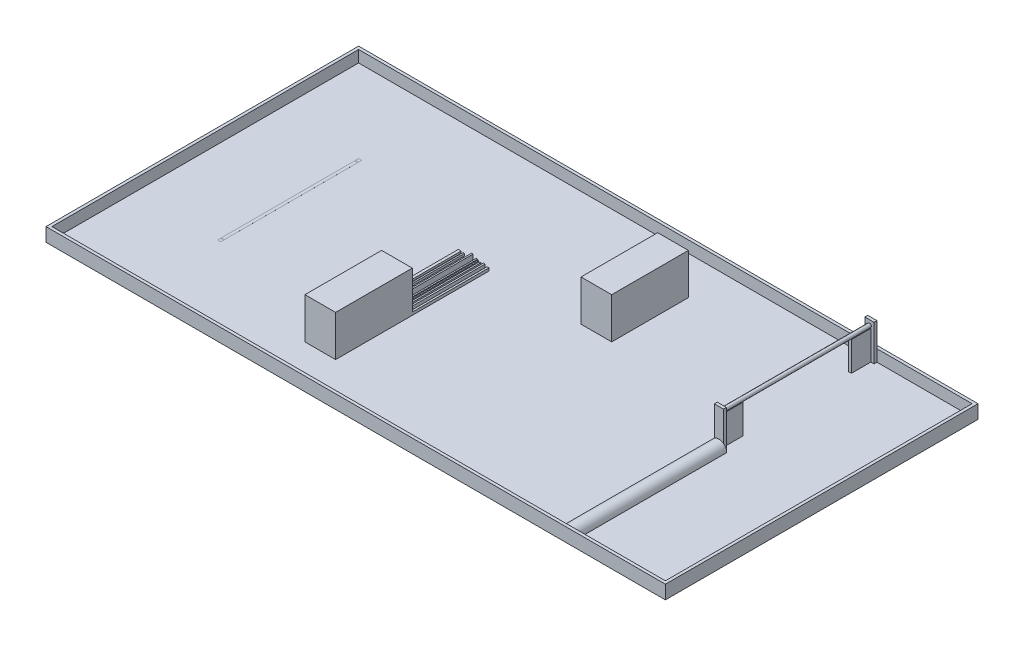
from build123d import *

# Parameters (mm, degrees)
SKETCH1_W            = 4000
SKETCH1_H            = 2000
BOSS_EXTRUDE1_DEPTH  = 12.7
SKETCH3_W            = 4038.1
SKETCH3_H            = 2038.1
SKETCH3_W_2          = 4000
SKETCH3_H_2          = 2000
BOSS_EXTRUDE2_DEPTH  = 88.9
SKETCH4_W            = 20
SKETCH4_H            = 20
BOSS_EXTRUDE3_DEPTH  = 0.1
SKETCH5_W            = 20
SKETCH5_H            = 870
BOSS_EXTRUDE4_DEPTH  = 0.1
BOSS_EXTRUDE5_DEPTH  = 1000
SKETCH7_W            = 60
SKETCH7_H            = 19.05
BOSS_EXTRUDE6_DEPTH  = 234.95
SKETCH8_W            = 19.05
SKETCH8_H            = 127
BOSS_EXTRUDE7_DEPTH  = 190.5
SKETCH9_R            = 12.7
BOSS_EXTRUDE10_DEPTH = 961.9
SKETCH10_W           = 200
SKETCH10_H           = 500
BOSS_EXTRUDE11_DEPTH = 266.7
BOSS_EXTRUDE12_DEPTH = 500


with BuildPart() as part:
    # Sketch1 → Boss-Extrude1 (new body)
    with BuildSketch(Plane(origin=(0, 0, 0), x_dir=(1, 0, 0), z_dir=(0, 1, 0))):
        Rectangle(SKETCH1_W, SKETCH1_H)
    extrude(amount=BOSS_EXTRUDE1_DEPTH)

    # Sketch3 → Boss-Extrude2 (add)
    with BuildSketch(Plane.XZ):
        Rectangle(SKETCH3_W, SKETCH3_H)
        Rectangle(SKETCH3_W_2, SKETCH3_H_2, mode=Mode.SUBTRACT)
    extrude(amount=-BOSS_EXTRUDE2_DEPTH)

    # Sketch4 → Boss-Extrude3 (add)
    with BuildSketch(Plane(origin=(0, 12.7, 0), x_dir=(1, 0, 0), z_dir=(0, 1, 0))):
        with Locations((-1450, -450)):
            Rectangle(SKETCH4_W, SKETCH4_H)
        with Locations((-1450, 450)):
            Rectangle(SKETCH4_W, SKETCH4_H)
    extrude(amount=BOSS_EXTRUDE3_DEPTH)

    # Sketch5 → Boss-Extrude4 (add)
    with BuildSketch(Plane(origin=(0, 12.7, 0), x_dir=(1, 0, 0), z_dir=(0, 1, 0))):
        with Locations((-1450, 0)):
            Rectangle(SKETCH5_W, SKETCH5_H)
    extrude(amount=BOSS_EXTRUDE4_DEPTH)

    # Sketch6 → Boss-Extrude5 (add)
    with BuildSketch(Plane(origin=(0, 0, 1000), x_dir=(-1, 0, 0), z_dir=(0, 0, -1))):
        with BuildLine():
            Line((-1400, 12.7), (-1298.4, 12.7))
            ThreePointArc((-1298.4, 12.7), (-1349.2, 63.5), (-1400, 12.7))
        make_face()
    extrude(amount=BOSS_EXTRUDE5_DEPTH)

    # Sketch7 → Boss-Extrude6 (add)
    with BuildSketch(Plane(origin=(0, 12.7, 0), x_dir=(1, 0, 0), z_dir=(0, 1, 0))):
        Polygon((1319.2, 19.05), (1319.2, 0), (1379.2, 0), (1379.2, 19.05), (1358.725, 19.05), (1339.675, 19.05), align=None)
        with Locations((1349.2, 990.475)):
            Rectangle(SKETCH7_W, SKETCH7_H)
    extrude(amount=BOSS_EXTRUDE6_DEPTH)

    # Sketch8 → Boss-Extrude7 (add)
    with BuildSketch(Plane(origin=(0, 12.7, 0), x_dir=(1, 0, 0), z_dir=(0, 1, 0))):
        with Locations((1349.2, 82.55)):
            Rectangle(SKETCH8_W, SKETCH8_H)
        with Locations((1349.2, 917.45)):
            Rectangle(SKETCH8_W, SKETCH8_H)
    extrude(amount=BOSS_EXTRUDE7_DEPTH)

    # Sketch9 → Boss-Extrude10 (add)
    with BuildSketch(Plane.XY.offset(-980.95)):
        with Locations(Location((1349.2, 215.7, 0), (0, 0, 259.818251612))):
            Circle(SKETCH9_R)
    extrude(amount=BOSS_EXTRUDE10_DEPTH)

    # Sketch10 → Boss-Extrude11 (add)
    with BuildSketch(Plane(origin=(0, 12.7, 0), x_dir=(1, 0, 0), z_dir=(0, 1, 0))):
        with Locations((-500, -500)):
            Rectangle(SKETCH10_W, SKETCH10_H)
        with Locations((300, 500)):
            Rectangle(SKETCH10_W, SKETCH10_H)
    extrude(amount=BOSS_EXTRUDE11_DEPTH)

    # Sketch11 → Boss-Extrude12 (add)
    with BuildSketch(Plane(origin=(0, 0, 250), x_dir=(-1, 0, 0), z_dir=(0, 0, -1))):
        Polygon((400, 12.7), (600, 12.7), (600, 34.925), (581.742402613, 34.925), (581.742402613, 22.030410547), (569.380193931, 22.030410547), (569.380193931, 32.238860877), (559.648727247, 32.238860877), (559.648727247, 17.687045982), (547.047232043, 17.687045982), (547.047232043, 22.030410547), (534.174715465, 22.030410547), (534.174715465, 29.629778615), (523.08338878, 29.629778615), (523.08338878, 42.447311207), (513.43581408, 42.447311207), (513.43581408, 57.15), (503.449058841, 57.15), (503.449058841, 22.030410547), (484.025227404, 22.030410547), (484.025227404, 42.447311207), (474.732898947, 42.447311207), (474.732898947, 36.354281235), (467.288779018, 36.354281235), (467.288779018, 29.629778615), (460.304552482, 29.629778615), (460.304552482, 33.786722079), (451.969100899, 33.786722079), (451.969100899, 16.685714799), (436.17051685, 16.685714799), (436.17051685, 40.017600307), (424.947561297, 40.017600307), (424.947561297, 19.241956924), (412.462295028, 19.241956924), (412.462295028, 31.360821094), (400, 31.360821094), align=None)
    extrude(amount=BOSS_EXTRUDE12_DEPTH)


solid = part.part
